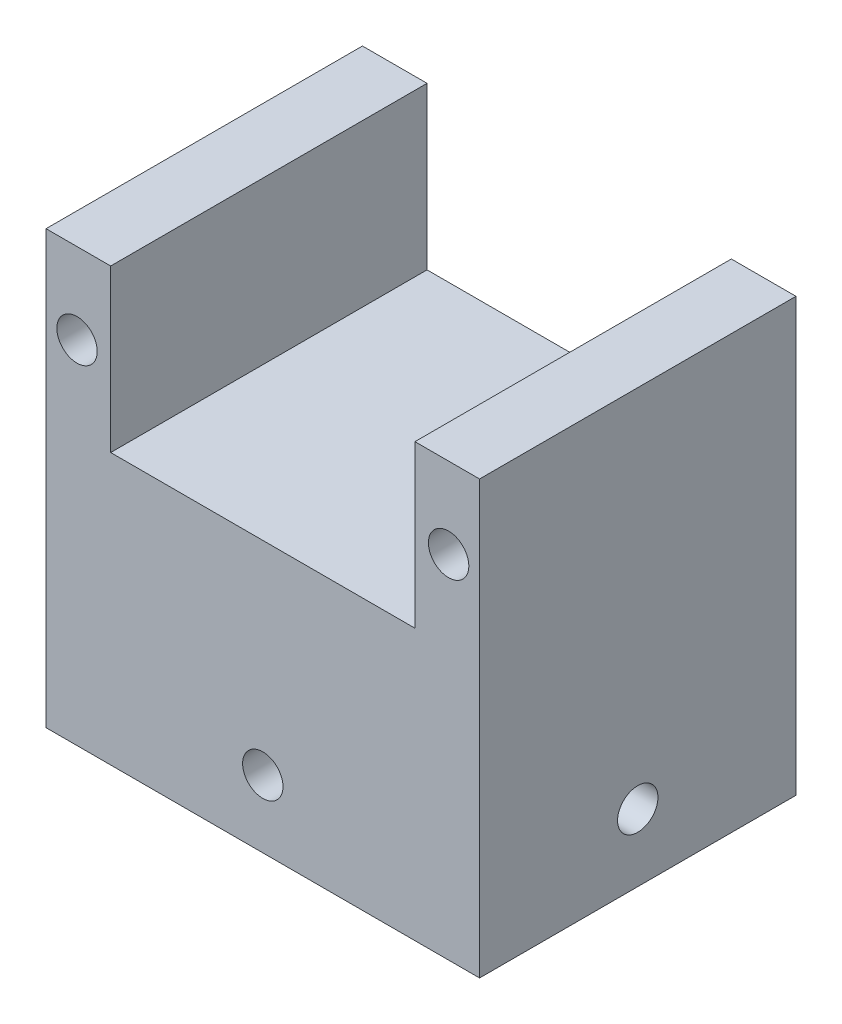
from build123d import *

# Parameters (mm, degrees)
SKETCH1_W           = 32.2
SKETCH1_H           = 23.5
BOSS_EXTRUDE1_DEPTH = 32.1
SKETCH2_R           = 1.5
SKETCH2_W           = 22.6
SKETCH2_H           = 12
CUT_EXTRUDE1_DEPTH  = 32.1
SKETCH3_R           = 1.5
CUT_EXTRUDE2_DEPTH  = 36.1


with BuildPart() as part:
    # Sketch1 → Boss-Extrude1 (new body)
    with BuildSketch(Plane(origin=(0, 0, 0), x_dir=(1, 0, 0), z_dir=(0, 1, 0))):
        with Locations((5.231046931, -2.217870036)):
            Rectangle(SKETCH1_W, SKETCH1_H)
    extrude(amount=BOSS_EXTRUDE1_DEPTH)

    # Sketch2 → Cut-Extrude1 (cut)
    with BuildSketch(Plane(origin=(0, 0, -9.532129964), x_dir=(-1, 0, 0), z_dir=(0, 0, -1))):
        with Locations((8.568953069, 26.1)):
            Circle(SKETCH2_R)
        with Locations((-19.031046931, 26.1)):
            Circle(SKETCH2_R)
        with Locations((-5.231046931, 5)):
            Circle(SKETCH2_R)
        with Locations((-5.231046931, 26.1)):
            Rectangle(SKETCH2_W, SKETCH2_H)
    extrude(amount=-CUT_EXTRUDE1_DEPTH, mode=Mode.SUBTRACT)

    # Sketch3 → Cut-Extrude2 (cut)
    with BuildSketch(Plane.ZY.offset(10.868953069)):
        with Locations((2.217870036, 5)):
            Circle(SKETCH3_R)
    extrude(amount=-CUT_EXTRUDE2_DEPTH, mode=Mode.SUBTRACT)


solid = part.part
